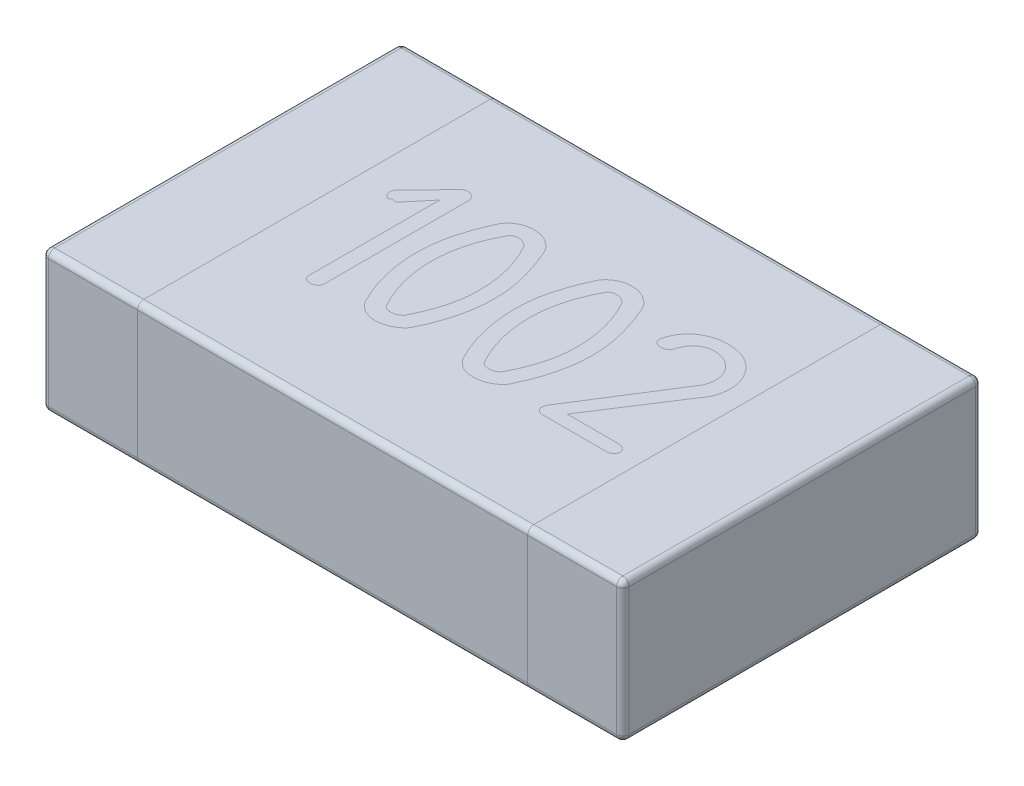
from build123d import *

# Parameters (mm, degrees)
BOSS_EXTRUDE1_DEPTH = 0.225
FILLET2_R           = 0.02


with BuildPart() as part:
    # Sketch1 → Boss-Extrude1 (new, symmetric)
    with BuildSketch(Plane(origin=(0, 0, 0), x_dir=(1, 0, 0), z_dir=(0, 1, 0))):
        with BuildLine():
            Line((-0.91, -0.575), (0.91, -0.575))
            ThreePointArc((0.91, -0.575), (0.924142136, -0.569142136), (0.93, -0.555))
            Line((0.93, -0.555), (0.93, 0.555))
            ThreePointArc((0.93, 0.555), (0.924142136, 0.569142136), (0.91, 0.575))
            Line((0.91, 0.575), (-0.91, 0.575))
            ThreePointArc((-0.91, 0.575), (-0.924142136, 0.569142136), (-0.93, 0.555))
            Line((-0.93, 0.555), (-0.93, -0.555))
            ThreePointArc((-0.93, -0.555), (-0.924142136, -0.569142136), (-0.91, -0.575))
        make_face()
    extrude(amount=BOSS_EXTRUDE1_DEPTH, both=True)

    # Fillet2
    fillet2_edges = [part.edges().sort_by_distance(p)[0] for p in [
        (0.924142136, 0.225, 0.569142136),
        (0, -0.225, 0.575),
        (-0.924142136, -0.225, 0.569142136),
        (0.93, 0.225, 0),
        (0.924142136, 0.225, -0.569142136),
        (0, 0.225, -0.575),
        (-0.924142136, 0.225, -0.569142136),
        (-0.93, 0.225, 0),
        (0, 0.225, 0.575),
        (0, 0.225, -0.575),
        (0, 0.225, -0.575),
        (0, 0.225, 0.575),
        (0, -0.225, 0.575),
        (0, -0.225, 0.575),
        (0, -0.225, -0.575),
        (0, -0.225, -0.575),
        (-0.924142136, 0.225, 0.569142136),
        (0, 0.225, 0.575),
        (-0.93, -0.225, 0),
        (-0.924142136, -0.225, -0.569142136),
        (0, -0.225, -0.575),
        (0.924142136, -0.225, -0.569142136),
        (0.93, -0.225, 0),
        (0.924142136, -0.225, 0.569142136),
    ]]
    fillet(fillet2_edges, radius=FILLET2_R)


solid = part.part
